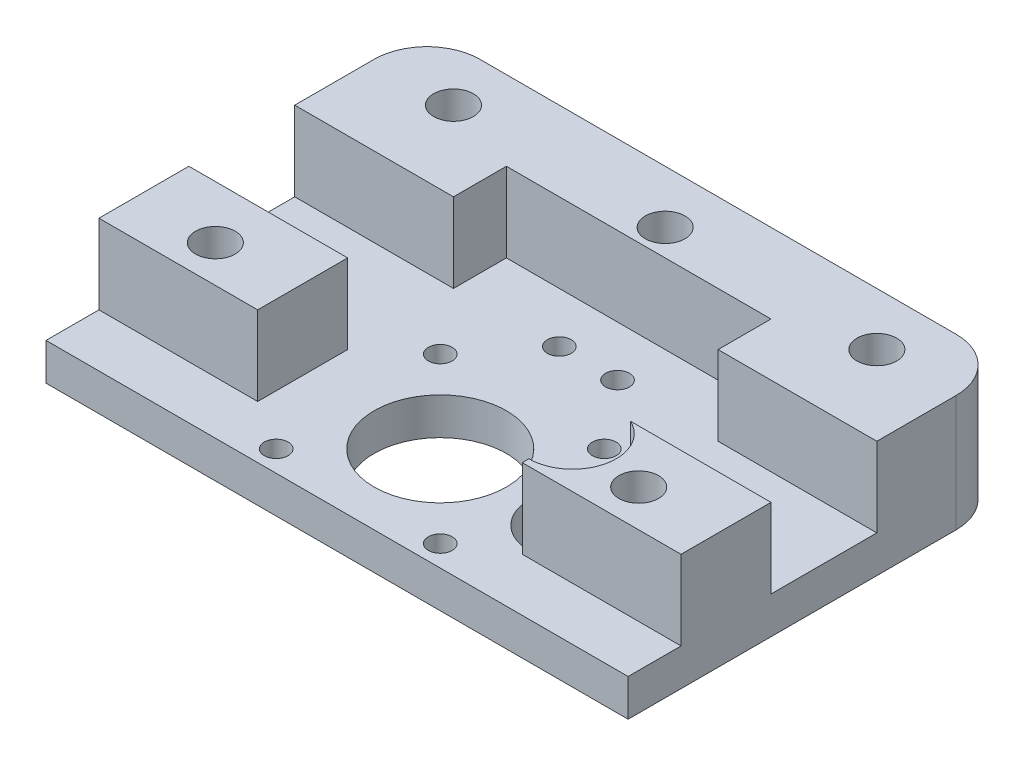
from build123d import *
from build123d.topology import SkipClean

# Parameters (mm, degrees)
SKETCH1_W           = 110
SKETCH1_H           = 72
SKETCH1_R           = 12.5
SKETCH1_R_2         = 2.25
SKETCH1_R_3         = 8.25
BOSS_EXTRUDE1_DEPTH = 7
BOSS_EXTRUDE2_DEPTH = 15
FILLET2_R           = 10
SKETCH3_R           = 3.75
CUT_EXTRUDE1_DEPTH  = 70.318107302
SKETCH4_W           = 30
SKETCH4_H           = 20
CUT_EXTRUDE2_DEPTH  = 15
CUT_EXTRUDE3_DEPTH  = 68.424031324


with BuildPart() as part:
    # Sketch1 → Boss-Extrude1 (new body)
    with BuildSketch(Plane(origin=(0, 0, 0), x_dir=(1, 0, 0), z_dir=(0, 1, 0))):
        Rectangle(SKETCH1_W, SKETCH1_H)
        with Locations(Location((0, -16.5, 0), (0, 0, 270))):
            Circle(SKETCH1_R, mode=Mode.SUBTRACT)
        with Locations(Location((-15.5, -32, 0), (0, 0, 270))):
            Circle(SKETCH1_R_2, mode=Mode.SUBTRACT)
        with Locations(Location((-15.5, -1, 0), (0, 0, 270))):
            Circle(SKETCH1_R_2, mode=Mode.SUBTRACT)
        with Locations(Location((15.5, -1, 0), (0, 0, 270))):
            Circle(SKETCH1_R_2, mode=Mode.SUBTRACT)
        with Locations(Location((15.5, -32, 0), (0, 0, 270))):
            Circle(SKETCH1_R_2, mode=Mode.SUBTRACT)
        with Locations(Location((25, -16.5, 0), (0, 0, 270))):
            Circle(SKETCH1_R_3, mode=Mode.SUBTRACT)
        with Locations(Location((-5.5, 11.5, 0), (0, 0, 270))):
            Circle(SKETCH1_R_2, mode=Mode.SUBTRACT)
        with Locations(Location((5.5, 11.5, 0), (0, 0, 270))):
            Circle(SKETCH1_R_2, mode=Mode.SUBTRACT)
    extrude(amount=BOSS_EXTRUDE1_DEPTH)

    # Sketch2 → Boss-Extrude2 (add)
    with BuildSketch(Plane(origin=(0, 7, 0), x_dir=(1, 0, 0), z_dir=(0, 1, 0))):
        Polygon((-55, 36), (55, 36), (55, -26), (25, -26), (25, 21), (-25, 21), (-25, -26), (-55, -26), align=None)
    extrude(amount=BOSS_EXTRUDE2_DEPTH)

    # Fillet2
    fillet2_edges = [part.edges().sort_by_distance(p)[0] for p in [
        (-55, 11, -36),
        (55, 11, -36),
    ]]
    fillet(fillet2_edges, radius=FILLET2_R)

    # Sketch3 → Cut-Extrude1 (cut, through all)
    with BuildSketch(Plane.XZ):
        with Locations(Location((40, -26, 0), (0, 0, 270))):
            Circle(SKETCH3_R)
        with Locations(Location((-40, -26, 0), (0, 0, 270))):
            Circle(SKETCH3_R)
        with Locations(Location((-40, 19, 0), (0, 0, 270))):
            Circle(SKETCH3_R)
        with Locations(Location((0, -26, 0), (0, 0, 270))):
            Circle(SKETCH3_R)
        with Locations(Location((40, 19, 0), (0, 0, 270))):
            Circle(SKETCH3_R)
    extrude(amount=-CUT_EXTRUDE1_DEPTH, mode=Mode.SUBTRACT)

    # Sketch4 → Cut-Extrude2 (cut)
    with BuildSketch(Plane(origin=(0, 22, 0), x_dir=(1, 0, 0), z_dir=(0, 1, 0))):
        with Locations((40, 1)):
            Rectangle(SKETCH4_W, SKETCH4_H)
        with Locations((-40, 1)):
            Rectangle(SKETCH4_W, SKETCH4_H)
    extrude(amount=-CUT_EXTRUDE2_DEPTH, mode=Mode.SUBTRACT)

    # Sketch5 → Cut-Extrude3 (cut, through all)
    with SkipClean():  # the faces are left unmerged after this step: merging them gives an invalid solid
        with BuildSketch(Plane.XZ.offset(-7)):
            with BuildLine():
                Line((25, 24.75), (25, 9))
                Line((25, 9), (28.436931771, 9))
                ThreePointArc((28.436931771, 9), (33.060319473, 18.25890591), (25, 24.75))
            make_face()
        extrude(amount=-CUT_EXTRUDE3_DEPTH, mode=Mode.SUBTRACT)


solid = part.part
